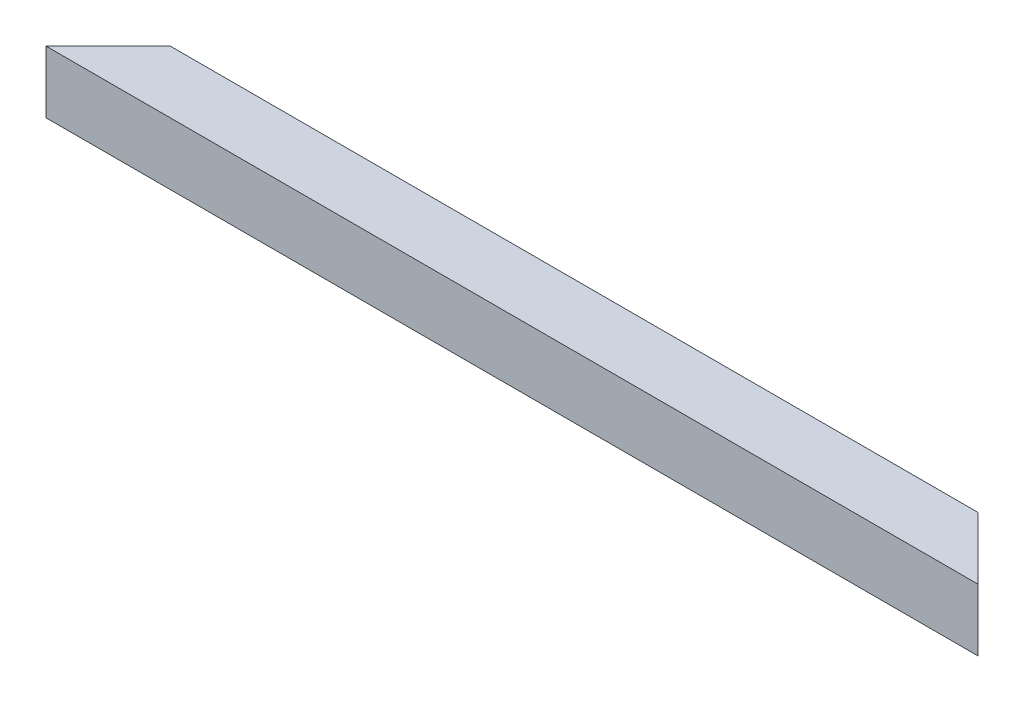
from build123d import *

# Parameters (mm, degrees)
EXTRUDE_1_DEPTH = 40


with BuildPart() as part:
    # Эскиз1 → Бобышка-Вытянуть1 (new body)
    with BuildSketch(Plane(origin=(0, 0, 0), x_dir=(1, 0, 0), z_dir=(0, 1, 0))):
        Polygon((220.728828249, -217.712147736), (180.728828249, -177.712147736), (-339.271171751, -177.712147736), (-379.271171751, -217.712147736), align=None)
    extrude(amount=EXTRUDE_1_DEPTH)


solid = part.part
